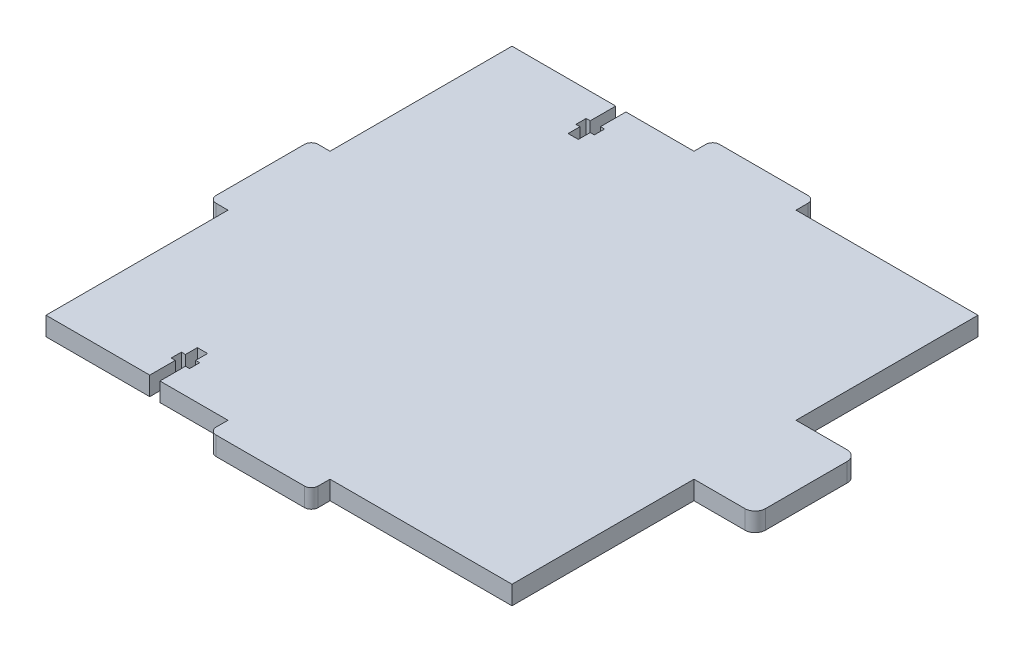
from build123d import *

# Parameters (mm, degrees)
BOSS_EXTRUDE1_DEPTH = 5.5
FILLET1_R           = 2
FILLET2_R           = 3


with BuildPart() as part:
    # Sketch1 → Boss-Extrude1 (new body)
    with BuildSketch(Plane(origin=(0, 0, 0), x_dir=(1, 0, 0), z_dir=(0, 1, 0))):
        Polygon((0, 83.5), (0, 137), (30.5, 137), (30.5, 129.5), (29.3, 129.5), (29.3, 126.5), (30.5, 126.5), (30.5, 123), (33.5, 123), (33.5, 126.5), (34.7, 126.5), (34.7, 129.5), (33.5, 129.5), (33.5, 137), (53.5, 137), (53.5, 142.5), (83.5, 142.5), (83.5, 137), (137, 137), (137, 83.5), (155, 83.5), (155, 53.5), (137, 53.5), (137, 0), (83.5, 0), (83.5, -5.5), (53.5, -5.5), (53.5, 0), (33.5, 0), (33.5, 7.5), (34.7, 7.5), (34.7, 10.5), (33.5, 10.5), (33.5, 14), (30.5, 14), (30.5, 10.5), (29.3, 10.5), (29.3, 7.5), (30.5, 7.5), (30.5, 0), (0, 0), (0, 53.5), (-5.5, 53.5), (-5.5, 83.5), align=None)
    extrude(amount=BOSS_EXTRUDE1_DEPTH)

    # Fillet1
    fillet1_edges = [part.edges().sort_by_distance(p)[0] for p in [
        (-5.5, 2.75, -53.5),
        (-5.5, 2.75, -83.5),
        (53.5, 2.75, -142.5),
        (83.5, 2.75, -142.5),
        (83.5, 2.75, 5.5),
        (53.5, 2.75, 5.5),
    ]]
    fillet(fillet1_edges, radius=FILLET1_R)

    # Fillet2
    fillet2_edges = [part.edges().sort_by_distance(p)[0] for p in [
        (155, 2.75, -83.5),
        (155, 2.75, -53.5),
    ]]
    fillet(fillet2_edges, radius=FILLET2_R)


solid = part.part
